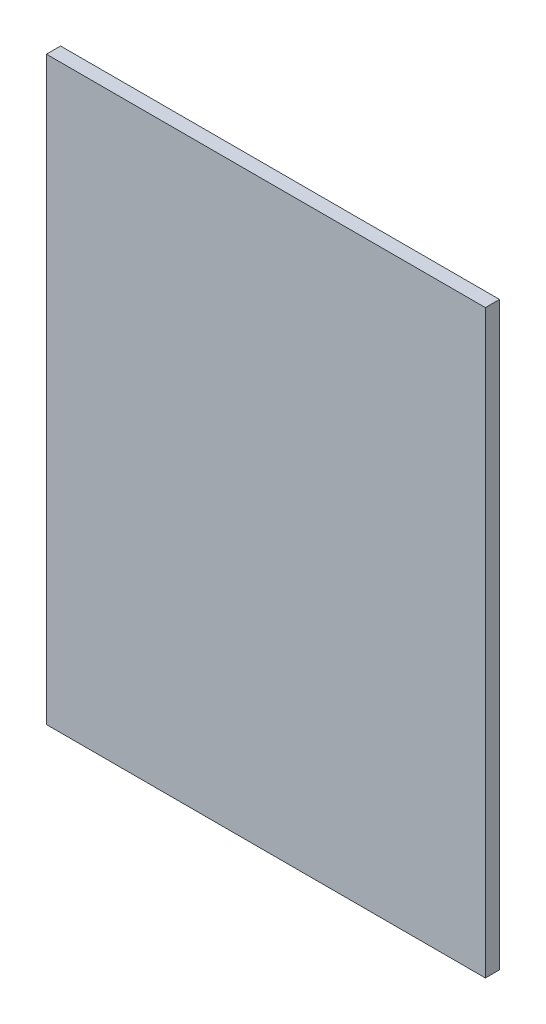
from build123d import *

# Parameters (mm, degrees)
ESQUISSE1_W        = 310
ESQUISSE1_H        = 410
BOSS_EXTRU_1_DEPTH = 10


with BuildPart() as part:
    # Esquisse1 → Boss.-Extru.1 (new body)
    with BuildSketch(Plane.XY):
        with Locations((-155, 205)):
            Rectangle(ESQUISSE1_W, ESQUISSE1_H)
    extrude(amount=BOSS_EXTRU_1_DEPTH)


solid = part.part
